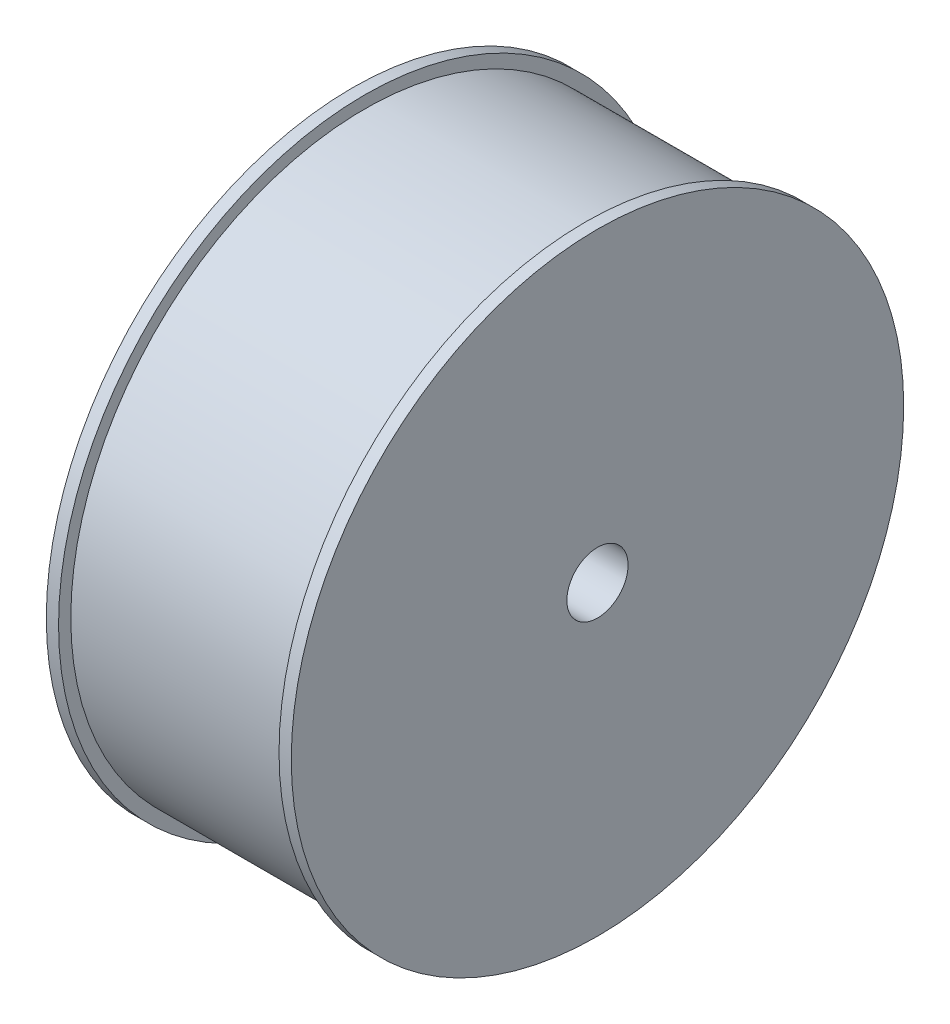
from build123d import *


with BuildPart() as part:
    # Sketch2 → Revolve1 (revolve)
    with BuildSketch(Plane.XY, mode=Mode.PRIVATE) as revolve1_sk:
        Polygon((-50, 12.5), (-50, 125), (-45, 125), (-45, 120), (45, 120), (45, 125), (50, 125), (50, 12.5), align=None)
    revolve(revolve1_sk.sketch.rotate(Axis((-72.639673571, 0, 0), (1, 0, 0)), 90), axis=Axis((-72.639673571, 0, 0), (1, 0, 0)))


solid = part.part
